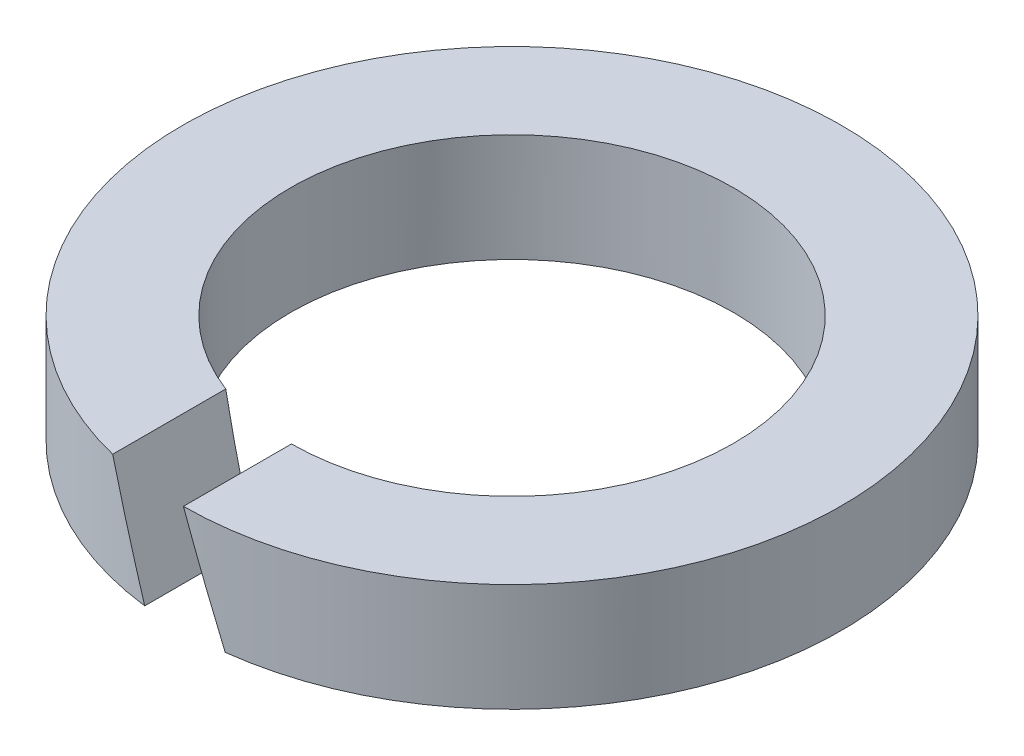
from build123d import *

# Parameters (mm, degrees)
SKE_W          = 1
SKE_H          = 1
CUT_REACH      = 6.428
CUT_END_RADIUS = 3.05


with BuildPart() as part:
    # Ske → Base (revolve)
    with BuildSketch(Plane.XY, mode=Mode.PRIVATE) as base_sk:
        with Locations((-2.55, 0.5)):
            Rectangle(SKE_W, SKE_H)
    revolve(base_sk.sketch.rotate(Axis((0, 15.759672306, 0), (0, -1, 0)), 270), axis=Axis((0, 15.759672306, 0), (0, -1, 0)))

    # Cut: up to this cylinder (the profile starts inside it)
    cut_end = Plane(origin=(0, 0.5, 0), z_dir=(0, 1, 0)) * Cylinder(CUT_END_RADIUS, 19.956, mode=Mode.PRIVATE)
    # Ske4 → Cut (cut, up to the surface)
    with BuildSketch(Plane.XY, mode=Mode.PRIVATE) as cut_sk1:
        Polygon((-0.37246222, 0), (0.37246222, 0), (0.008491986, 1), (-0.736432455, 1), align=None)
    cut_tool1 = extrude(cut_sk1.sketch, amount=CUT_REACH, mode=Mode.PRIVATE) & cut_end
    add(cut_tool1.solids().sort_by_distance((-0.181985, 0.5, 0))[0], mode=Mode.SUBTRACT)


solid = part.part
